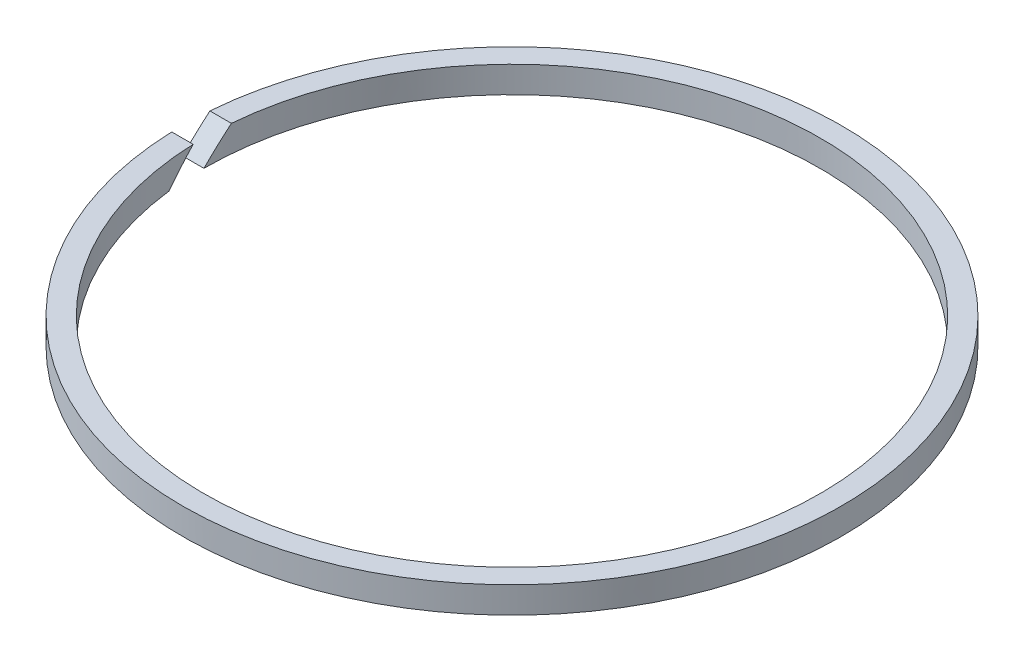
from build123d import *

# Parameters (mm, degrees)
SKETCH1_R               = 12.7
SKETCH1_R_2             = 11.8745
BOSS_EXTRUDE1_DEPTH     = 1.016
CUT_EXTRUDE1_REACH      = 19.989
CUT_EXTRUDE1_END_RADIUS = 12.7


with BuildPart() as part:
    # Sketch1 → Boss-Extrude1 (new body)
    with BuildSketch(Plane(origin=(0, 0, 0), x_dir=(1, 0, 0), z_dir=(0, 1, 0))):
        Circle(SKETCH1_R)
        Circle(SKETCH1_R_2, mode=Mode.SUBTRACT)
    extrude(amount=BOSS_EXTRUDE1_DEPTH)

    # Cut-Extrude1: up to this cylinder (the profile starts inside it)
    cut_extrude1_end = Plane(origin=(0, 0.508, 0), z_dir=(0, -1, 0)) * Cylinder(CUT_EXTRUDE1_END_RADIUS, 66.378, mode=Mode.PRIVATE)
    # Sketch2 → Cut-Extrude1 (cut, up to the surface)
    with BuildSketch(Plane(origin=(0, 0, 0), x_dir=(0, 0, -1), z_dir=(1, 0, 0)), mode=Mode.PRIVATE) as cut_extrude1_sk1:
        Polygon((0, 0), (1.016, 1.016), (-0.420840979, 1.016), (-1.436840979, 0), align=None)
    cut_extrude1_tool1 = extrude(cut_extrude1_sk1.sketch, amount=-CUT_EXTRUDE1_REACH, mode=Mode.PRIVATE) & cut_extrude1_end
    add(cut_extrude1_tool1.solids().sort_by_distance((0, 0.508, 0.21042))[0], mode=Mode.SUBTRACT)


solid = part.part
